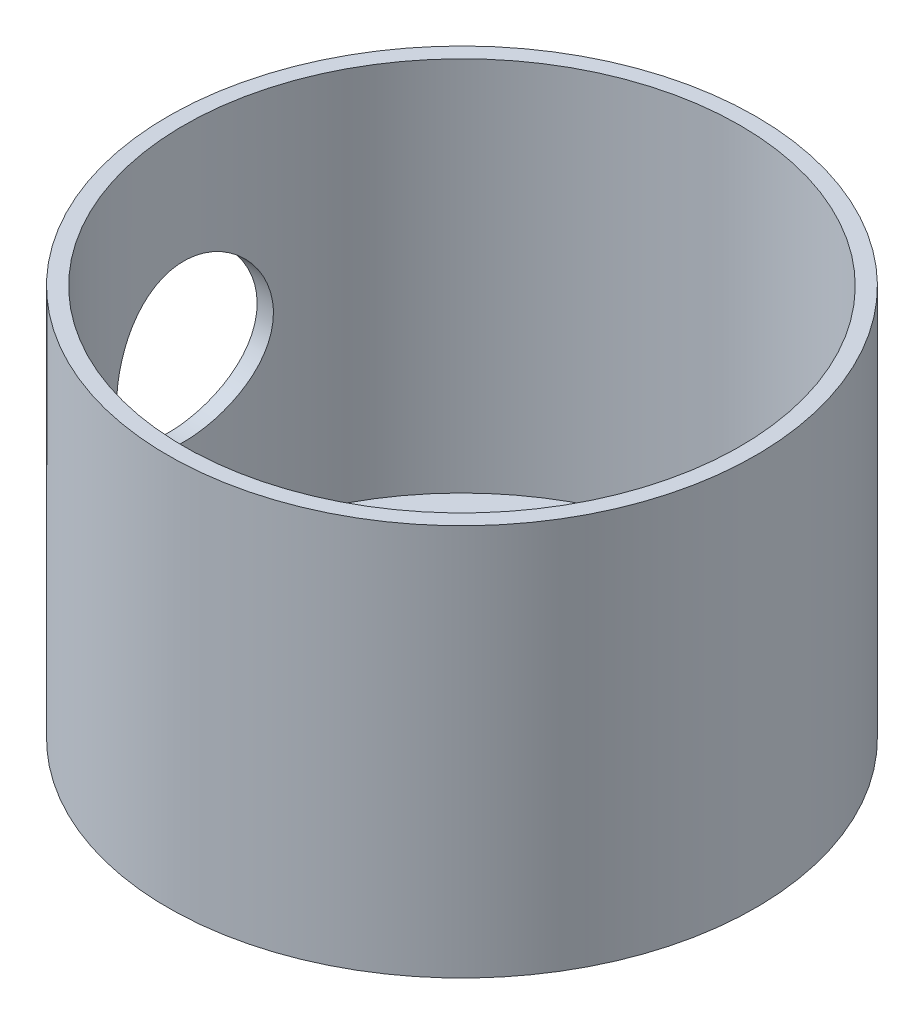
from build123d import *

# Parameters (mm, degrees)
SKETCH2_R          = 4
CUT_EXTRUDE1_DEPTH = 10
SKETCH3_R          = 4
CUT_EXTRUDE2_DEPTH = 18


with BuildPart() as part:
    # Sketch1 → Revolve1 (revolve)
    with BuildSketch(Plane.XY, mode=Mode.PRIVATE) as revolve1_sk:
        Polygon((-15, 17.7), (-15, 37.7), (-14.2, 37.7), (-14.2, 18.5), (0, 18.5), (0, 17.7), align=None)
    revolve(revolve1_sk.sketch.rotate(Axis((0, 0, 0), (0, 1, 0)), 270), axis=Axis((0, 0, 0), (0, 1, 0)))

    # Sketch2 → Cut-Extrude1 (cut)
    with BuildSketch(Plane(origin=(0, 18.5, 0), x_dir=(1, 0, 0), z_dir=(0, 1, 0))):
        with Locations(Location((0, 0, 0), (0, 0, 270))):
            Circle(SKETCH2_R)
    extrude(amount=-CUT_EXTRUDE1_DEPTH, mode=Mode.SUBTRACT)

    # Sketch3 → Cut-Extrude2 (cut)
    with BuildSketch(Plane(origin=(0, 0, 0), x_dir=(0, 0, -1), z_dir=(1, 0, 0))):
        with Locations((0, 27.7)):
            Circle(SKETCH3_R)
    extrude(amount=-CUT_EXTRUDE2_DEPTH, mode=Mode.SUBTRACT)


solid = part.part
